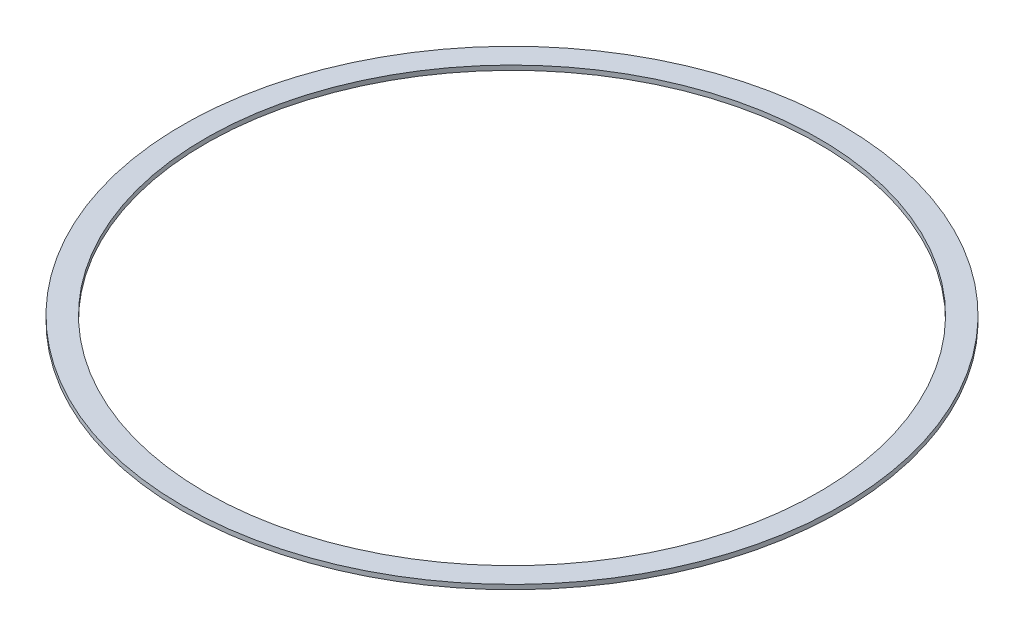
from build123d import *

# Parameters (mm, degrees)
SKETCH1_R           = 215
SKETCH1_R_2         = 200
BOSS_EXTRUDE1_DEPTH = 1.5


with BuildPart() as part:
    # Sketch1 → Boss-Extrude1 (new, symmetric)
    with BuildSketch(Plane(origin=(0, 0, 0), x_dir=(1, 0, 0), z_dir=(0, 1, 0))):
        with Locations(Location((0, 0, 0), (0, 0, 270))):
            Circle(SKETCH1_R)
        with Locations(Location((0, 0, 0), (0, 0, 270))):
            Circle(SKETCH1_R_2, mode=Mode.SUBTRACT)
    extrude(amount=BOSS_EXTRUDE1_DEPTH, both=True)


solid = part.part
